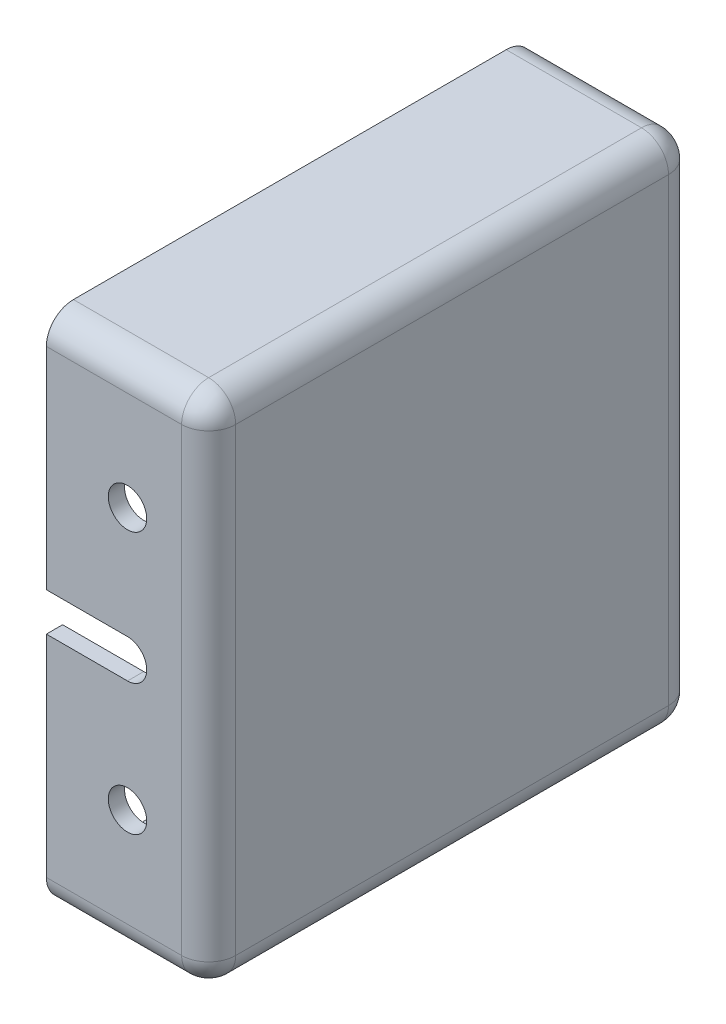
from build123d import *

# Parameters (mm, degrees)
SKETCH1_W                                   = 95
SKETCH1_H                                   = 30
BOSS_EXTRUDE1_DEPTH                         = 90
F_2_MM_TOP_BOT_3_MM_SIDE_T                  = -3
F_2_MM_TOP_BOT_3_MM_SIDE_THICKNESS_2_FACE_W = 84
F_2_MM_TOP_BOT_3_MM_SIDE_THICKNESS_2_FACE_H = 27
F_2_MM_TOP_BOT_3_MM_SIDE_THICKNESS_2_DEPTH  = 2
F_2_MM_TOP_BOT_3_MM_SIDE_THICKNESS_3_FACE_W = 84
F_2_MM_TOP_BOT_3_MM_SIDE_THICKNESS_3_FACE_H = 27
F_2_MM_TOP_BOT_3_MM_SIDE_THICKNESS_3_DEPTH  = 2
SKETCH4_R                                   = 3.55
F_7_1_MM_FIXTURE_HOLES_DEPTH                = 10
F_5_MM_RADIUS_R                             = 5
CUT_EXTRUDE1_DEPTH                          = 10


with BuildPart() as part:
    # Sketch1 → Boss-Extrude1 (new body)
    with BuildSketch(Plane(origin=(0, 0, 0), x_dir=(0, 1, 0), z_dir=(0, 0, 1))):
        Rectangle(SKETCH1_W, SKETCH1_H)
    extrude(amount=BOSS_EXTRUDE1_DEPTH)

    # 2 mm top/bot 3 mm side
    f_2_mm_top_bot_3_mm_side_openings = [part.faces().sort_by_distance(p)[0] for p in [
        (-15, 0, 45),
    ]]
    offset(amount=F_2_MM_TOP_BOT_3_MM_SIDE_T, openings=f_2_mm_top_bot_3_mm_side_openings, kind=Kind.INTERSECTION)

    # 2 mm top/bot 3 mm side thickness 2 face (on inner face of the shell) → 2 mm top/bot 3 mm side thickness 2 (add)
    with BuildSketch(Plane(origin=(-1.5, 44.5, 45), x_dir=(0, 0, 1), z_dir=(0, 1, 0))):
        Rectangle(F_2_MM_TOP_BOT_3_MM_SIDE_THICKNESS_2_FACE_W, F_2_MM_TOP_BOT_3_MM_SIDE_THICKNESS_2_FACE_H)
    extrude(amount=-F_2_MM_TOP_BOT_3_MM_SIDE_THICKNESS_2_DEPTH)

    # 2 mm top/bot 3 mm side thickness 3 face (on inner face of the shell) → 2 mm top/bot 3 mm side thickness 3 (add)
    with BuildSketch(Plane(origin=(-1.5, -44.5, 45), x_dir=(0, 0, -1), z_dir=(0, -1, 0))):
        Rectangle(F_2_MM_TOP_BOT_3_MM_SIDE_THICKNESS_3_FACE_W, F_2_MM_TOP_BOT_3_MM_SIDE_THICKNESS_3_FACE_H)
    extrude(amount=-F_2_MM_TOP_BOT_3_MM_SIDE_THICKNESS_3_DEPTH)

    # Sketch4 → 7.1 mm fixture holes (cut)
    with BuildSketch(Plane.XY.offset(90)):
        with Locations((0, 24.2)):
            Circle(SKETCH4_R)
        Circle(SKETCH4_R)
        with Locations((0, -24.2)):
            Circle(SKETCH4_R)
        with BuildLine():
            ThreePointArc((0, -3.55), (-3.55, 0), (0, 3.55))
            Line((0, 3.55), (-15, 3.55))
            Line((-15, 3.55), (-15, -3.55))
            Line((-15, -3.55), (0, -3.55))
        make_face()
    extrude(amount=-F_7_1_MM_FIXTURE_HOLES_DEPTH, mode=Mode.SUBTRACT)

    # 5 mm radius
    f_5_mm_radius_edges = [part.edges().sort_by_distance(p)[0] for p in [
        (0, 47.5, 90),
        (12, 0, 3),
        (12, -42.5, 45),
        (-1.5, 42.5, 3),
        (12, 42.5, 45),
        (-1.5, -42.5, 87),
        (12, 0, 87),
        (-1.5, 42.5, 87),
        (-1.5, -42.5, 3),
        (0, -47.5, 90),
        (15, 0, 90),
        (0, -47.5, 0),
        (0, 47.5, 0),
        (15, 0, 0),
        (15, -47.5, 45),
        (15, 47.5, 45),
    ]]
    fillet(f_5_mm_radius_edges, radius=F_5_MM_RADIUS_R)

    # Sketch3 → Cut-Extrude1 (cut)
    with BuildSketch(Plane(origin=(0, 0, 0), x_dir=(1, 0, 0), z_dir=(0, 0, -1))):
        with BuildLine():
            ThreePointArc((5, 32.5), (3.535533906, 36.035533906), (0, 37.5))
            Line((0, 37.5), (0, 27.5))
            ThreePointArc((0, 27.5), (3.535533906, 28.964466094), (5, 32.5))
        make_face()
        with BuildLine():
            Line((0, 27.5), (0, 37.5))
            ThreePointArc((0, 37.5), (-5, 32.5), (0, 27.5))
        make_face()
        with BuildLine():
            ThreePointArc((5, 12.5), (3.535533906, 16.035533906), (0, 17.5))
            Line((0, 17.5), (0, 7.5))
            ThreePointArc((0, 7.5), (3.535533906, 8.964466094), (5, 12.5))
        make_face()
        with BuildLine():
            Line((0, 7.5), (0, 17.5))
            ThreePointArc((0, 17.5), (-5, 12.5), (0, 7.5))
        make_face()
        with BuildLine():
            ThreePointArc((5, -7.5), (3.535533906, -3.964466094), (0, -2.5))
            Line((0, -2.5), (0, -12.5))
            ThreePointArc((0, -12.5), (3.535533906, -11.035533906), (5, -7.5))
        make_face()
        with BuildLine():
            Line((0, -12.5), (0, -2.5))
            ThreePointArc((0, -2.5), (-5, -7.5), (0, -12.5))
        make_face()
        with BuildLine():
            ThreePointArc((5, -27.5), (3.535533906, -23.964466094), (0, -22.5))
            Line((0, -22.5), (0, -27.5))
            Line((0, -27.5), (0, -32.5))
            ThreePointArc((0, -32.5), (3.535533906, -31.035533906), (5, -27.5))
        make_face()
        with BuildLine():
            Line((0, -27.5), (0, -22.5))
            ThreePointArc((0, -22.5), (-5, -27.5), (0, -32.5))
            Line((0, -32.5), (0, -27.5))
        make_face()
    extrude(amount=-CUT_EXTRUDE1_DEPTH, mode=Mode.SUBTRACT)


solid = part.part
